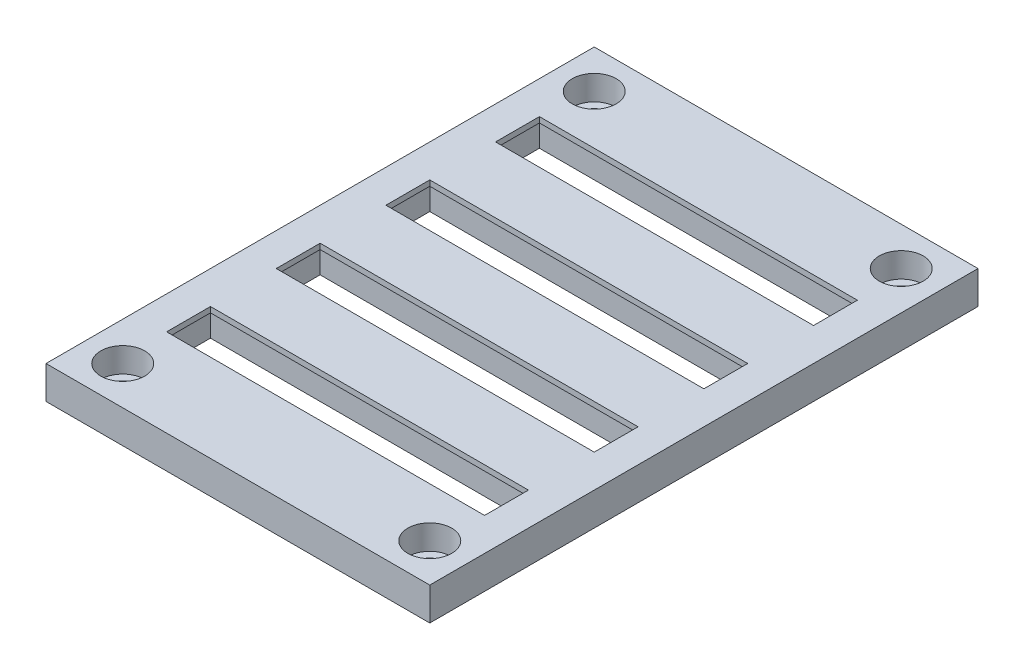
from build123d import *

# Parameters (mm, degrees)
SKETCH1_W           = 70
SKETCH1_H           = 100
BOSS_EXTRUDE1_DEPTH = 6
SKETCH3_W           = 60
SKETCH3_H           = 10
CUT_EXTRUDE1_DEPTH  = 5
SKETCH4_W           = 58
SKETCH4_H           = 8
CUT_EXTRUDE2_DEPTH  = 1
SKETCH5_R           = 2.5
CUT_EXTRUDE3_DEPTH  = 10
SKETCH6_R           = 4
CUT_EXTRUDE4_DEPTH  = 4.5


with BuildPart() as part:
    # Sketch1 → Boss-Extrude1 (new body)
    with BuildSketch(Plane(origin=(0, 0, 0), x_dir=(1, 0, 0), z_dir=(0, 1, 0))):
        with Locations((35, 50)):
            Rectangle(SKETCH1_W, SKETCH1_H)
    extrude(amount=BOSS_EXTRUDE1_DEPTH)

    # Sketch3 → Cut-Extrude1 (cut)
    with BuildSketch(Plane.XZ):
        with Locations((35, -20)):
            Rectangle(SKETCH3_W, SKETCH3_H)
        with Locations((35, -40)):
            Rectangle(SKETCH3_W, SKETCH3_H)
        with Locations((35, -60)):
            Rectangle(SKETCH3_W, SKETCH3_H)
        with Locations((35, -80)):
            Rectangle(SKETCH3_W, SKETCH3_H)
    extrude(amount=-CUT_EXTRUDE1_DEPTH, mode=Mode.SUBTRACT)

    # Sketch4 → Cut-Extrude2 (cut)
    with BuildSketch(Plane.XZ.offset(-5)):
        with Locations((35, -20)):
            Rectangle(SKETCH4_W, SKETCH4_H)
        with Locations((35, -40)):
            Rectangle(SKETCH4_W, SKETCH4_H)
        with Locations((35, -60)):
            Rectangle(SKETCH4_W, SKETCH4_H)
        with Locations((35, -80)):
            Rectangle(SKETCH4_W, SKETCH4_H)
    extrude(amount=-CUT_EXTRUDE2_DEPTH, mode=Mode.SUBTRACT)

    # Sketch5 → Cut-Extrude3 (cut)
    with BuildSketch(Plane.XZ):
        with Locations(Location((63, -7, 0), (0, 0, 270))):
            Circle(SKETCH5_R)
        with Locations(Location((7, -7, 0), (0, 0, 270))):
            Circle(SKETCH5_R)
        with Locations(Location((63, -93, 0), (0, 0, 270))):
            Circle(SKETCH5_R)
        with Locations(Location((7, -93, 0), (0, 0, 270))):
            Circle(SKETCH5_R)
    extrude(amount=-CUT_EXTRUDE3_DEPTH, mode=Mode.SUBTRACT)

    # Sketch6 → Cut-Extrude4 (cut)
    with BuildSketch(Plane(origin=(0, 6, 0), x_dir=(1, 0, 0), z_dir=(0, 1, 0))):
        with Locations(Location((7, 93, 0), (0, 0, 270))):
            Circle(SKETCH6_R)
        with Locations(Location((63, 93, 0), (0, 0, 90))):
            Circle(SKETCH6_R)
        with Locations(Location((63, 7, 0), (0, 0, 270))):
            Circle(SKETCH6_R)
        with Locations(Location((7, 7, 0), (0, 0, 90))):
            Circle(SKETCH6_R)
    extrude(amount=-CUT_EXTRUDE4_DEPTH, mode=Mode.SUBTRACT)


solid = part.part
